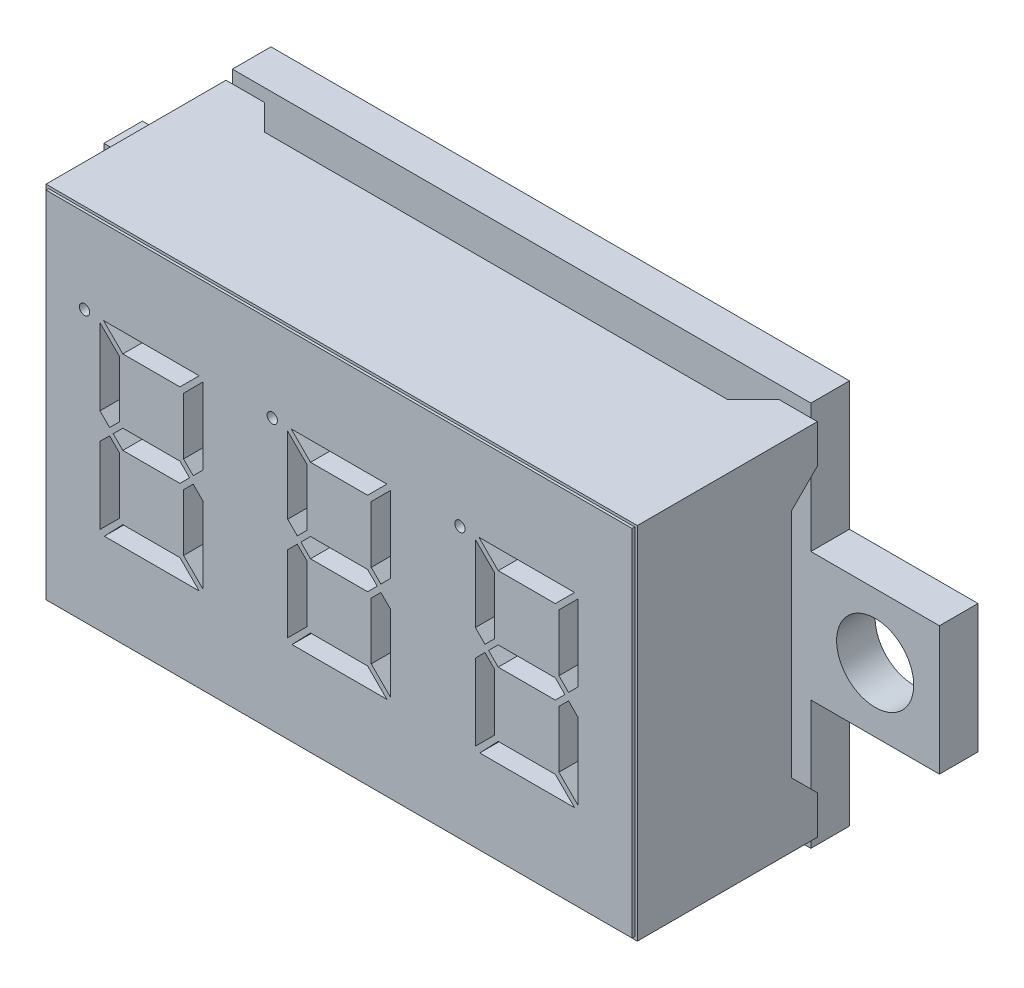
from build123d import *

# Parameters (mm, degrees)
SKETCH_1_R             = 1.5
EXTRUDE_1_DEPTH        = 1.5
SKETCH_2_W             = 23
SKETCH_2_H             = 14
EXTRUDE_2_DEPTH        = 7
CUT_EXTRUDE_3_DEPTH    = 33.229644739
CUT_EXTRUDE_5_DEPTH    = 33.669749004
SKETCH_6_W             = 0.5
SKETCH_6_H             = 0.5
EXTRUDE_3_DEPTH        = 7
SKETCH_8_R             = 0.3
EXTRUDE_4_DEPTH        = 0.5
SKETCH_9_W             = 22.8
SKETCH_9_H             = 13.8
EXTRUDE_5_DEPTH        = 0.1
CUT_EXTRUDE_6_DEPTH    = 1
PATTERN_LINEAR_1_COUNT = 3
PATTERN_LINEAR_1_PITCH = 7.3
SKETCH_13_R            = 0.2
CUT_EXTRUDE_7_DEPTH    = 1


with BuildPart() as part:
    # 草图1 → 凸台-拉伸1 (new body)
    with BuildSketch(Plane.XY):
        Polygon((0, 10), (0, 15), (22.5, 15), (22.5, 10), (27.5, 10), (27.5, 5), (22.5, 5), (22.5, 0), (0, 0), (0, 5), (-5, 5), (-5, 10), align=None)
        with Locations((-2.5, 7.5)):
            Circle(SKETCH_1_R, mode=Mode.SUBTRACT)
        with Locations((25, 7.5)):
            Circle(SKETCH_1_R, mode=Mode.SUBTRACT)
    extrude(amount=EXTRUDE_1_DEPTH)

    # 草图2 → 凸台-拉伸2 (add)
    with BuildSketch(Plane.XY.offset(1.5)):
        with Locations((11.25, 7.5)):
            Rectangle(SKETCH_2_W, SKETCH_2_H)
    extrude(amount=EXTRUDE_2_DEPTH)

    # 草图3 → 切除-拉伸3 (cut, through all)
    with BuildSketch(Plane.XZ.offset(-0.5)):
        Polygon((1.25, 1.5), (2.25, 2.5), (20.25, 2.5), (21.25, 1.5), align=None)
    extrude(amount=-CUT_EXTRUDE_3_DEPTH, mode=Mode.SUBTRACT)

    # 草图4 → 切除-拉伸5 (cut, through all)
    with BuildSketch(Plane(origin=(22.75, 0, 0), x_dir=(0, 0, -1), z_dir=(1, 0, 0))):
        Polygon((-1.5, 2), (-2.5, 3), (-2.5, 12), (-1.5, 13), align=None)
    extrude(amount=-CUT_EXTRUDE_5_DEPTH, mode=Mode.SUBTRACT)

    # 草图6 → 凸台-拉伸3 (add)
    with BuildSketch(Plane(origin=(0, 0, -1), x_dir=(-1, 0, 0), z_dir=(0, 0, -1))):
        with Locations((-4.75, 2.25)):
            Rectangle(SKETCH_6_W, SKETCH_6_H)
        with Locations((-7.25, 2.25)):
            Rectangle(SKETCH_6_W, SKETCH_6_H)
        with Locations((-9.75, 2.25)):
            Rectangle(SKETCH_6_W, SKETCH_6_H)
        with Locations((-12.25, 2.25)):
            Rectangle(SKETCH_6_W, SKETCH_6_H)
        with Locations((-14.75, 2.25)):
            Rectangle(SKETCH_6_W, SKETCH_6_H)
        with Locations((-17.25, 2.25)):
            Rectangle(SKETCH_6_W, SKETCH_6_H)
        with Locations((-17.25, 12.75)):
            Rectangle(SKETCH_6_W, SKETCH_6_H)
        with Locations((-14.75, 12.75)):
            Rectangle(SKETCH_6_W, SKETCH_6_H)
        with Locations((-12.25, 12.75)):
            Rectangle(SKETCH_6_W, SKETCH_6_H)
        with Locations((-9.75, 12.75)):
            Rectangle(SKETCH_6_W, SKETCH_6_H)
        with Locations((-7.25, 12.75)):
            Rectangle(SKETCH_6_W, SKETCH_6_H)
    extrude(amount=-EXTRUDE_3_DEPTH)

    # 草图8 → 凸台-拉伸4 (add)
    with BuildSketch(Plane(origin=(0, 0, 0), x_dir=(-1, 0, 0), z_dir=(0, 0, -1))):
        with Locations(Location((-1, 14, 0), (0, 0, 180))):
            Circle(SKETCH_8_R)
        with Locations(Location((-2.5, 14, 0), (0, 0, 180))):
            Circle(SKETCH_8_R)
        with Locations(Location((-4, 14, 0), (0, 0, 180))):
            Circle(SKETCH_8_R)
    extrude(amount=EXTRUDE_4_DEPTH)

    # 草图9 → 凸台-拉伸5 (add)
    with BuildSketch(Plane.XY.offset(8.5)):
        with Locations((11.25, 7.5)):
            Rectangle(SKETCH_9_W, SKETCH_9_H)
    extrude(amount=EXTRUDE_5_DEPTH)

    # 草图12 → 切除-拉伸6 (cut)
    with BuildSketch(Plane.XY.offset(8.6)):
        Polygon((20.408578644, 3.875), (16.719105739, 3.875), (17.438572565, 4.625), (19.658578644, 4.625), align=None)
        Polygon((20.55, 4.016421356), (20.55, 6.983578644), (20.175, 7.358578644), (19.8, 6.983578644), (19.8, 4.766421356), align=None)
        Polygon((20.408578644, 11.125), (16.688572565, 11.125), (17.438572565, 10.375), (19.658578644, 10.375), align=None)
        Polygon((19.658578644, 7.125), (17.438572565, 7.125), (17.063572565, 7.5), (17.438572565, 7.875), (19.658578644, 7.875), (20.033578644, 7.5), align=None)
        Polygon((19.8, 8.016421356), (19.8, 10.233578644), (20.55, 10.983578644), (20.55, 8.016421356), (20.175, 7.641421356), align=None)
        Polygon((17.3, 8.013572565), (17.3, 10.233578644), (16.55, 10.983578644), (16.55, 8.013572565), (16.925, 7.638572565), align=None)
        Polygon((17.3, 4.766421356), (16.55, 4.016421356), (16.547151209, 6.983578644), (16.923575604, 7.360003039), (17.3, 6.983578644), align=None)
    cut_extrude_6 = extrude(amount=-CUT_EXTRUDE_6_DEPTH, mode=Mode.SUBTRACT)

    # 阵列(线性)1: 切除-拉伸6 ×3
    with Locations(*[(-i * PATTERN_LINEAR_1_PITCH, 0, 0) for i in range(1, PATTERN_LINEAR_1_COUNT)]):
        add(cut_extrude_6, mode=Mode.SUBTRACT)

    # 草图13 → 切除-拉伸7 (cut)
    with BuildSketch(Plane.XY.offset(8.6)):
        with Locations((15.95, 11.125)):
            Circle(SKETCH_13_R)
        with Locations((8.65, 11.125)):
            Circle(SKETCH_13_R)
        with Locations((1.35, 11.125)):
            Circle(SKETCH_13_R)
    extrude(amount=-CUT_EXTRUDE_7_DEPTH, mode=Mode.SUBTRACT)


solid = part.part
